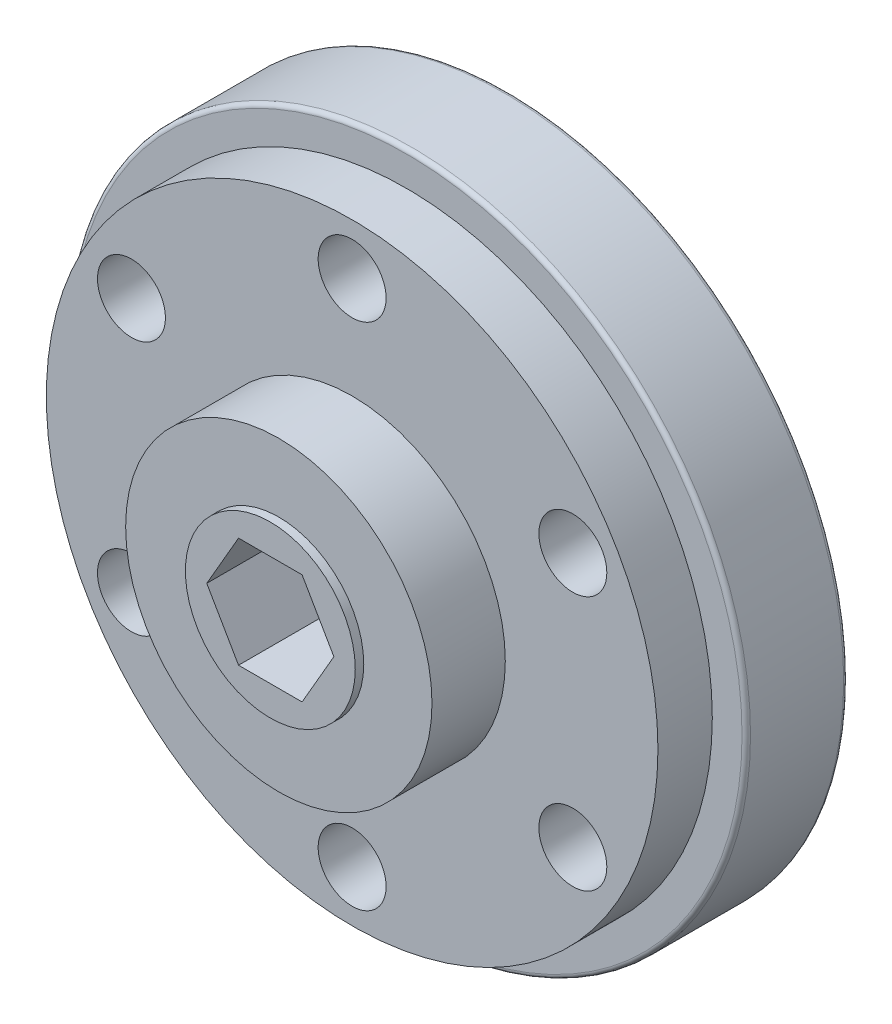
from build123d import *

# Parameters (mm, degrees)
SKETCH1_R              = 31.75
BOSS_EXTRUDE1_DEPTH    = 22.225
SKETCH2_R              = 13.49375
SKETCH2_R_2            = 7.9375
CUT_EXTRUDE1_DEPTH     = 1.5875
SKETCH3_OUTSIDE_W      = 84.002
SKETCH3_OUTSIDE_H      = 84.002
SKETCH3_OUTSIDE_R      = 14.3129
CUT_EXTRUDE2_DEPTH     = 7.6454
SKETCH7_OUTSIDE_W      = 84.002
SKETCH7_OUTSIDE_H      = 84.002
SKETCH7_OUTSIDE_R      = 28.575
CUT_EXTRUDE3_DEPTH     = 5.08
F_10_CLEARANCE_HOLE1_D = 6.35
CUT_EXTRUDE4_DEPTH     = 6.35
CIRPATTERN1_COUNT      = 6
SKETCH9_R              = 29.174800712
SKETCH9_R_2            = 18.6055
BOSS_EXTRUDE2_DEPTH    = 0.6
FILLET1_R              = 0.396875
SKETCH10_OUTSIDE_W     = 84.002
SKETCH10_OUTSIDE_H     = 84.002
SKETCH10_OUTSIDE_R     = 7.9375
CUT_EXTRUDE5_DEPTH     = 0.79375


with BuildPart() as part:
    # Sketch1 → Boss-Extrude1 (new body)
    with BuildSketch(Plane.XY):
        Circle(SKETCH1_R)
        Polygon((2.96960111, -5.1435), (5.939202219, 0), (2.96960111, 5.1435), (-2.96960111, 5.1435), (-5.939202219, 0), (-2.96960111, -5.1435), align=None, mode=Mode.SUBTRACT)
    extrude(amount=BOSS_EXTRUDE1_DEPTH)

    # Sketch2 → Cut-Extrude1 (cut)
    with BuildSketch(Plane(origin=(0, 0, 0), x_dir=(-1, 0, 0), z_dir=(0, 0, -1))):
        Circle(SKETCH2_R)
        Circle(SKETCH2_R_2, mode=Mode.SUBTRACT)
    extrude(amount=-CUT_EXTRUDE1_DEPTH, mode=Mode.SUBTRACT)

    # Sketch3 outside → Cut-Extrude2 (cut)
    with BuildSketch(Plane.XY.offset(22.225)):
        Rectangle(SKETCH3_OUTSIDE_W, SKETCH3_OUTSIDE_H)
        Circle(SKETCH3_OUTSIDE_R, mode=Mode.SUBTRACT)
    extrude(amount=-CUT_EXTRUDE2_DEPTH, mode=Mode.SUBTRACT)

    # Sketch7 outside → Cut-Extrude3 (cut)
    with BuildSketch(Plane.XY.offset(14.5796)):
        Rectangle(SKETCH7_OUTSIDE_W, SKETCH7_OUTSIDE_H)
        Circle(SKETCH7_OUTSIDE_R, mode=Mode.SUBTRACT)
    extrude(amount=-CUT_EXTRUDE3_DEPTH, mode=Mode.SUBTRACT)

    # #10 Clearance Hole1 (through all)
    with Locations(Plane.XY.offset(14.5796)):
        with Locations((0, 23.8125)):
            f_10_clearance_hole1 = Hole(F_10_CLEARANCE_HOLE1_D / 2)

    # Sketch8 → Cut-Extrude4 (cut)
    with BuildSketch(Plane(origin=(0, 0, 0), x_dir=(-1, 0, 0), z_dir=(0, 0, -1))):
        Polygon((3.006262852, 18.6055), (6.012525703, 23.8125), (3.006262852, 29.0195), (-3.006262852, 29.0195), (-6.012525703, 23.8125), (-3.006262852, 18.6055), align=None)
    cut_extrude4 = extrude(amount=-CUT_EXTRUDE4_DEPTH, mode=Mode.SUBTRACT)

    # CirPattern1: #10 Clearance Hole1, Cut-Extrude4 ×6 about axis
    cirpattern1_axis = Axis((0, 0, 0), (0, 0, 1))
    add([f_10_clearance_hole1.rotate(cirpattern1_axis, i * 360 / CIRPATTERN1_COUNT) for i in range(1, CIRPATTERN1_COUNT)], mode=Mode.SUBTRACT)
    add([cut_extrude4.rotate(cirpattern1_axis, i * 360 / CIRPATTERN1_COUNT) for i in range(1, CIRPATTERN1_COUNT)], mode=Mode.SUBTRACT)

    # Sketch9 → Boss-Extrude2 (add)
    with BuildSketch(Plane(origin=(0, 0, 6.35), x_dir=(-1, 0, 0), z_dir=(0, 0, -1))):
        Circle(SKETCH9_R)
        Circle(SKETCH9_R_2, mode=Mode.SUBTRACT)
    extrude(amount=-BOSS_EXTRUDE2_DEPTH)

    # Fillet1
    fillet1_edges = [part.edges().sort_by_distance(p)[0] for p in [
        (-31.75, 0, 0),
        (13.49375, 0, 0),
        (7.9375, 0, 0),
        (-31.75, 0, 9.4996),
    ]]
    fillet(fillet1_edges, radius=FILLET1_R)

    # Sketch10 outside → Cut-Extrude5 (cut)
    with BuildSketch(Plane.XY.offset(22.225)):
        Rectangle(SKETCH10_OUTSIDE_W, SKETCH10_OUTSIDE_H)
        with Locations(Location((0, 0, 0), (0, 0, 180))):
            Circle(SKETCH10_OUTSIDE_R, mode=Mode.SUBTRACT)
    extrude(amount=-CUT_EXTRUDE5_DEPTH, mode=Mode.SUBTRACT)


solid = part.part
